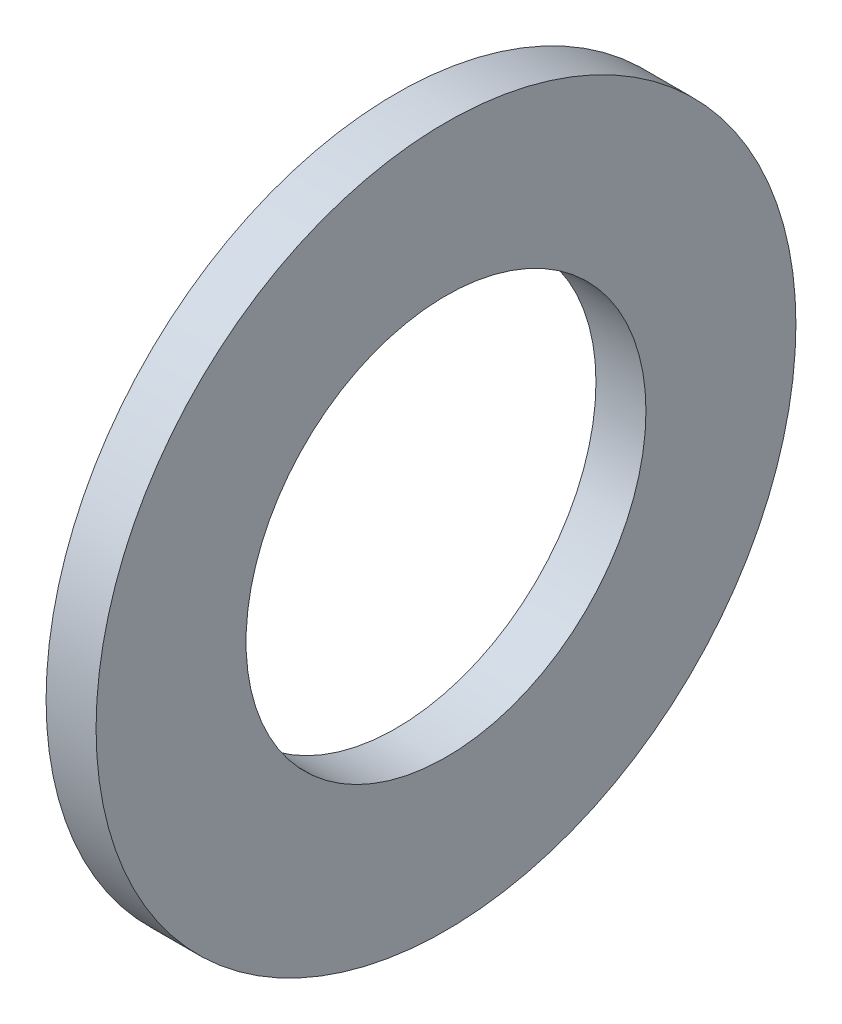
from build123d import *

# Parameters (mm, degrees)
SKETCH_1_R      = 3.5
SKETCH_1_R_2    = 2
EXTRUDE_1_DEPTH = 0.5


with BuildPart() as part:
    # 草图1 → 凸台-拉伸1 (new body)
    with BuildSketch(Plane(origin=(0, 0, 0), x_dir=(0, 0, -1), z_dir=(1, 0, 0))):
        Circle(SKETCH_1_R)
        Circle(SKETCH_1_R_2, mode=Mode.SUBTRACT)
    extrude(amount=EXTRUDE_1_DEPTH)


solid = part.part
